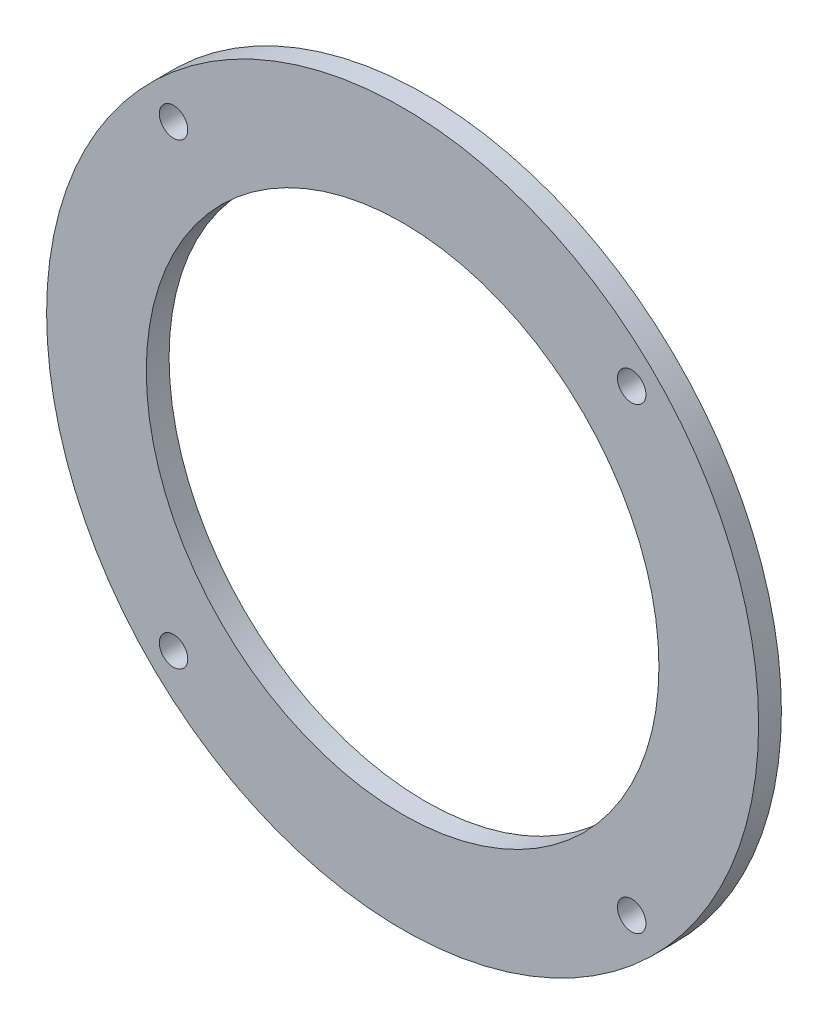
from build123d import *

# Parameters (mm, degrees)
SKETCH1_R           = 25
SKETCH1_R_2         = 18
SKETCH1_R_3         = 1
BOSS_EXTRUDE2_DEPTH = 1.6
SKETCH2_W           = 1.2
SKETCH2_H           = 2.3
BOSS_EXTRUDE3_DEPTH = 0.1


with BuildPart() as part:
    # Sketch1 → Boss-Extrude2 (new body)
    with BuildSketch(Plane.XY):
        Circle(SKETCH1_R)
        Circle(SKETCH1_R_2, mode=Mode.SUBTRACT)
        with Locations((16.086679272, -16.086679272)):
            Circle(SKETCH1_R_3, mode=Mode.SUBTRACT)
        with Locations((-16.086679272, -16.086679272)):
            Circle(SKETCH1_R_3, mode=Mode.SUBTRACT)
        with Locations((-16.086679272, 16.086679272)):
            Circle(SKETCH1_R_3, mode=Mode.SUBTRACT)
        with Locations((16.086679272, 16.086679272)):
            Circle(SKETCH1_R_3, mode=Mode.SUBTRACT)
    extrude(amount=BOSS_EXTRUDE2_DEPTH)

    # Sketch2 → Boss-Extrude3 (add)
    with BuildSketch(Plane.XY):
        with Locations((1.3, 22.65)):
            Rectangle(SKETCH2_W, SKETCH2_H)
        with Locations((3.9, 22.65)):
            Rectangle(SKETCH2_W, SKETCH2_H)
        with Locations((-3.9, 22.65)):
            Rectangle(SKETCH2_W, SKETCH2_H)
        with Locations((-1.3, 22.65)):
            Rectangle(SKETCH2_W, SKETCH2_H)
    extrude(amount=-BOSS_EXTRUDE3_DEPTH)


solid = part.part
